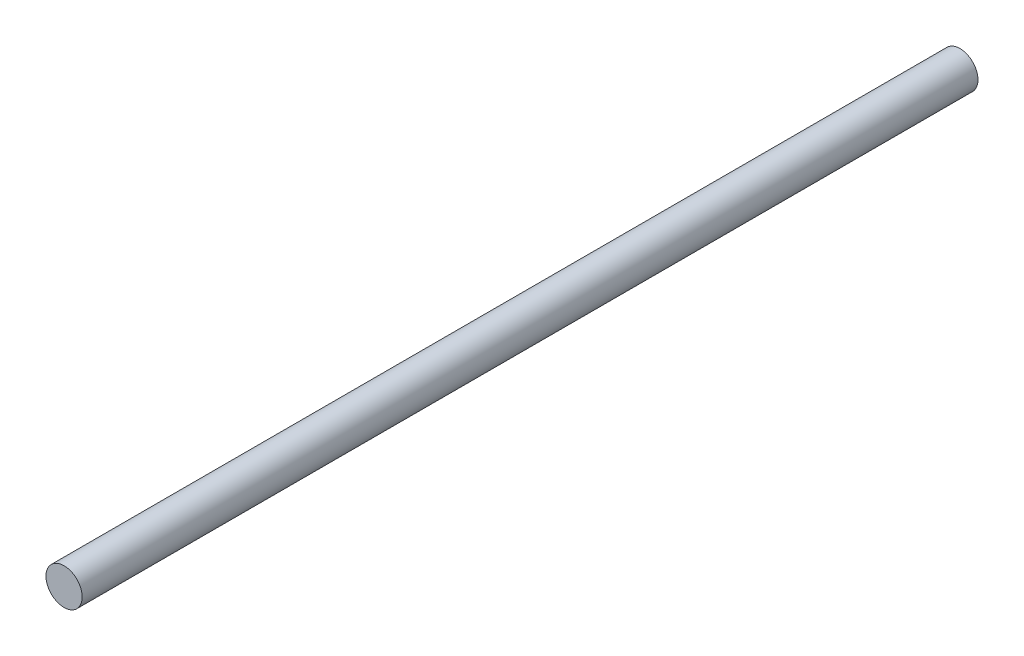
from build123d import *

# Parameters (mm, degrees)
SKETCH_1_R      = 10
EXTRUDE_2_DEPTH = 495


with BuildPart() as part:
    # 草图1 → 凸台-拉伸2 (new body)
    with BuildSketch(Plane.XY):
        Circle(SKETCH_1_R)
    extrude(amount=EXTRUDE_2_DEPTH)


solid = part.part
